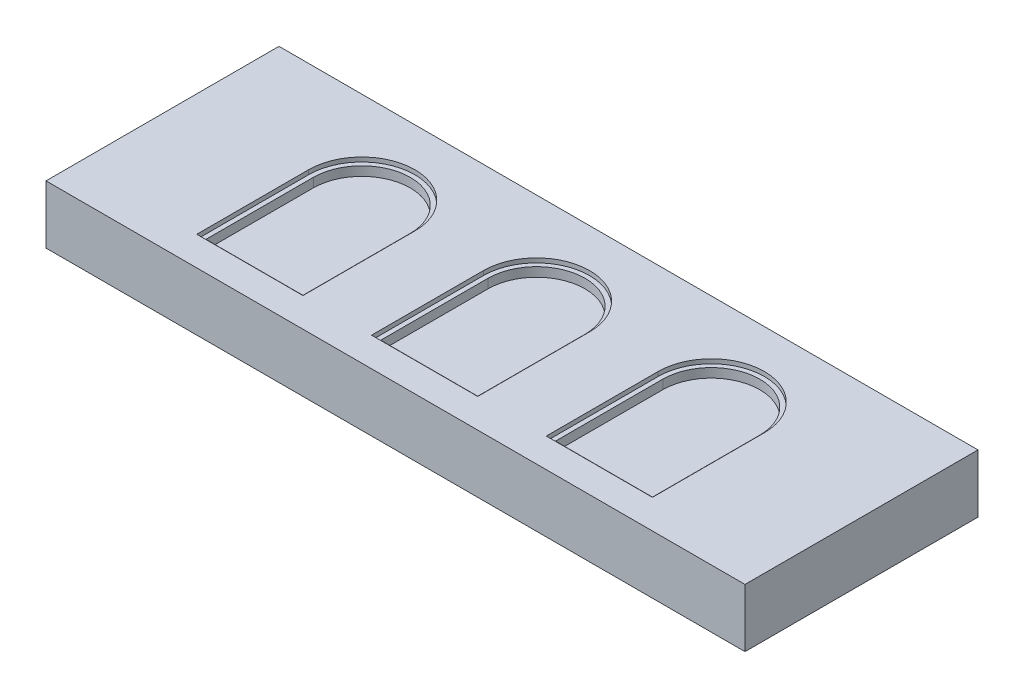
from build123d import *

# Parameters (mm, degrees)
SKETCH1_W           = 152.4
SKETCH1_H           = 50.8
BOSS_EXTRUDE1_DEPTH = 12.7
CUT_EXTRUDE1_DEPTH  = 0.95
CUT_EXTRUDE2_DEPTH  = 2
LPATTERN1_COUNT     = 2
LPATTERN1_PITCH     = 38.1
LPATTERN1_COL_COUNT = 2
LPATTERN1_COL_PITCH = 38.1


with BuildPart() as part:
    # Sketch1 → Boss-Extrude1 (new body)
    with BuildSketch(Plane(origin=(0, 0, 0), x_dir=(1, 0, 0), z_dir=(0, 1, 0))):
        with Locations((76.2, 25.4)):
            Rectangle(SKETCH1_W, SKETCH1_H)
    extrude(amount=BOSS_EXTRUDE1_DEPTH)

    # Sketch2 → Cut-Extrude1 (cut)
    with BuildSketch(Plane(origin=(0, 12.7, 0), x_dir=(1, 0, 0), z_dir=(0, 1, 0))):
        with BuildLine():
            Line((64.626998, 30.75), (64.626998, 6.35))
            Line((64.626998, 6.35), (87.773002, 6.35))
            Line((87.773002, 6.35), (87.773002, 30.75))
            ThreePointArc((87.773002, 30.75), (76.2, 42.323002), (64.626998, 30.75))
        make_face()
    cut_extrude1 = extrude(amount=-CUT_EXTRUDE1_DEPTH, mode=Mode.SUBTRACT)

    # Sketch3 → Cut-Extrude2 (cut)
    with BuildSketch(Plane(origin=(0, 11.75, 0), x_dir=(1, 0, 0), z_dir=(0, 1, 0))):
        with BuildLine():
            Line((65.626998, 30.75), (65.626998, 7.35))
            Line((65.626998, 7.35), (86.773002, 7.35))
            Line((86.773002, 7.35), (86.773002, 30.75))
            ThreePointArc((86.773002, 30.75), (76.2, 41.323002), (65.626998, 30.75))
        make_face()
    cut_extrude2 = extrude(amount=-CUT_EXTRUDE2_DEPTH, mode=Mode.SUBTRACT)

    # LPattern1: Cut-Extrude1, Cut-Extrude2 ×2
    with Locations(*[(i * LPATTERN1_PITCH, 0, 0) for i in range(1, LPATTERN1_COUNT)]):
        add(cut_extrude1, mode=Mode.SUBTRACT)
        add(cut_extrude2, mode=Mode.SUBTRACT)

    # LPattern1 col: Cut-Extrude1, Cut-Extrude2 ×2
    with Locations(*[(-i * LPATTERN1_COL_PITCH, 0, 0) for i in range(1, LPATTERN1_COL_COUNT)]):
        add(cut_extrude1, mode=Mode.SUBTRACT)
        add(cut_extrude2, mode=Mode.SUBTRACT)


solid = part.part
